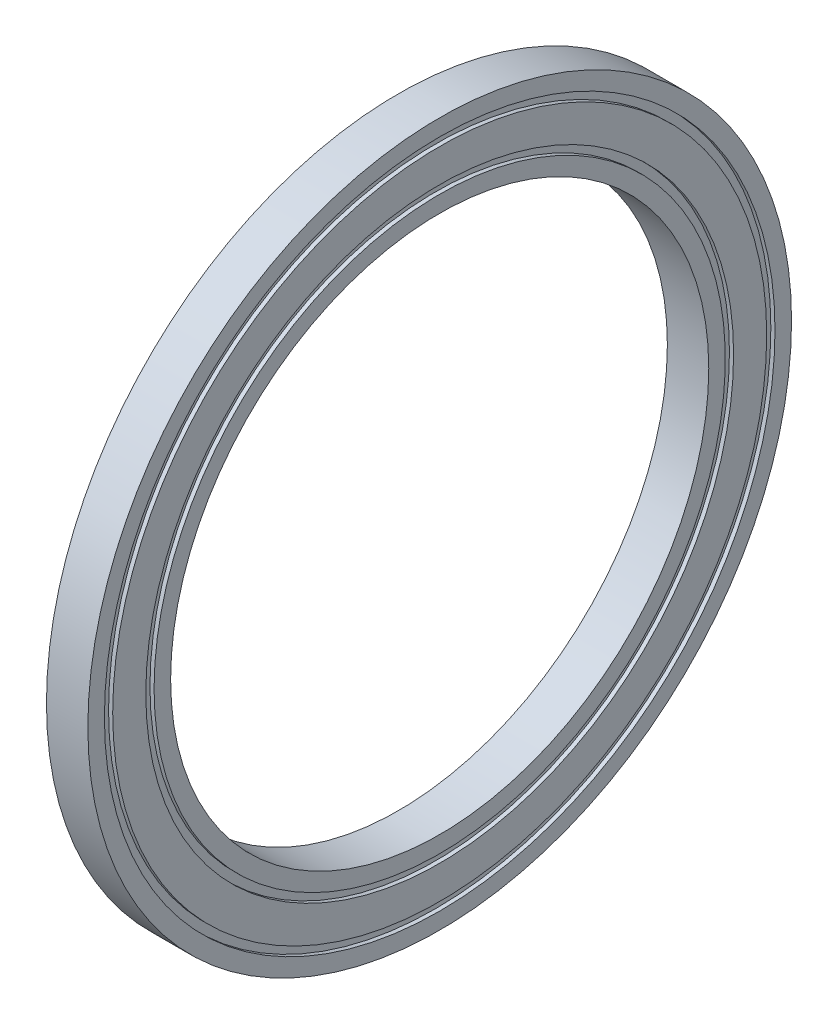
from build123d import *


with BuildPart() as part:
    # Sketch1 → Revolve1 (revolve)
    with BuildSketch(Plane.XY, mode=Mode.PRIVATE) as revolve1_sk:
        Polygon((-2.5, 42.5), (2.5, 42.5), (2.5, 40.5), (2, 40.5), (2, 39.5), (2.5, 39.5), (2.5, 35.5), (2, 35.5), (2, 34.5), (2.5, 34.5), (2.5, 32.5), (-2.5, 32.5), (-2.5, 34.5), (-2, 34.5), (-2, 35.5), (-2.5, 35.5), (-2.5, 39.5), (-2, 39.5), (-2, 40.5), (-2.5, 40.5), align=None)
    revolve(revolve1_sk.sketch.rotate(Axis((0, 0, 0), (1, 0, 0)), 90), axis=Axis((0, 0, 0), (1, 0, 0)))


solid = part.part
